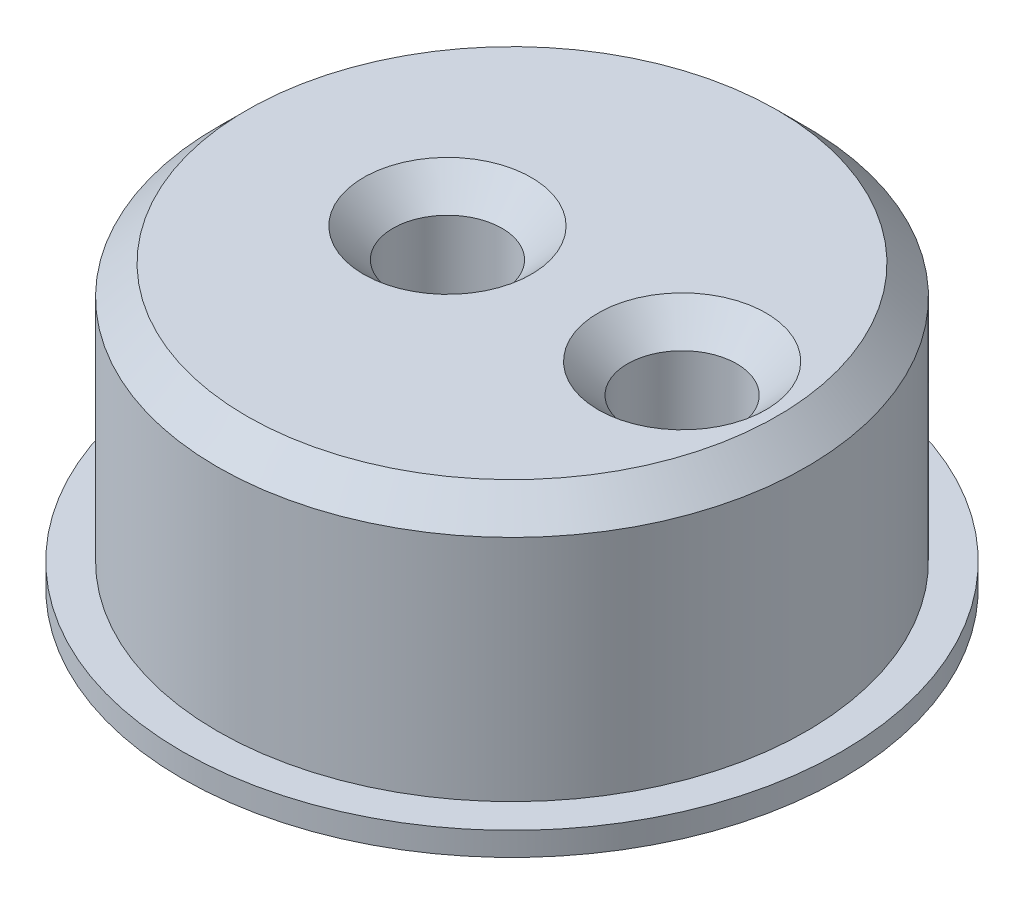
from build123d import *

# Parameters (mm, degrees)
SKETCH_1_R      = 5.02
SKETCH_1_R_2    = 0.93
EXTRUDE_1_DEPTH = 4.4
EXTRUDE_START   = 0.4
SKETCH_3_R      = 5.62
SKETCH_3_R_2    = 0.93
EXTRUDE_2_DEPTH = 0.4
CHAMFER_1_SIZE  = 0.5


with BuildPart() as part:
    # 草图1 → 凸台-拉伸1 (new body)
    with BuildSketch(Plane(origin=(0, 0, 0), x_dir=(1, 0, 0), z_dir=(0, 1, 0))):
        Circle(SKETCH_1_R)
        with Locations((2.9, 0)):
            Circle(SKETCH_1_R_2, mode=Mode.SUBTRACT)
        with Locations((-1.1, 0)):
            Circle(SKETCH_1_R_2, mode=Mode.SUBTRACT)
    extrude(amount=EXTRUDE_1_DEPTH)

    # 草图3 → 凸台-拉伸2 (add)
    with BuildSketch(Plane.XZ.offset(EXTRUDE_START)):
        Circle(SKETCH_3_R)
        with Locations((2.9, 0)):
            Circle(SKETCH_3_R_2, mode=Mode.SUBTRACT)
        with Locations((-1.1, 0)):
            Circle(SKETCH_3_R_2, mode=Mode.SUBTRACT)
    extrude(amount=-EXTRUDE_2_DEPTH)

    # 倒角1
    chamfer_1_edges = [part.edges().sort_by_distance(p)[0] for p in [
        (-5.02, 4.4, 0),
        (-2.03, 4.4, 0),
        (1.97, 4.4, 0),
        (-2.03, -0.4, 0),
        (1.97, -0.4, 0),
    ]]
    chamfer(chamfer_1_edges, length=CHAMFER_1_SIZE)


solid = part.part
